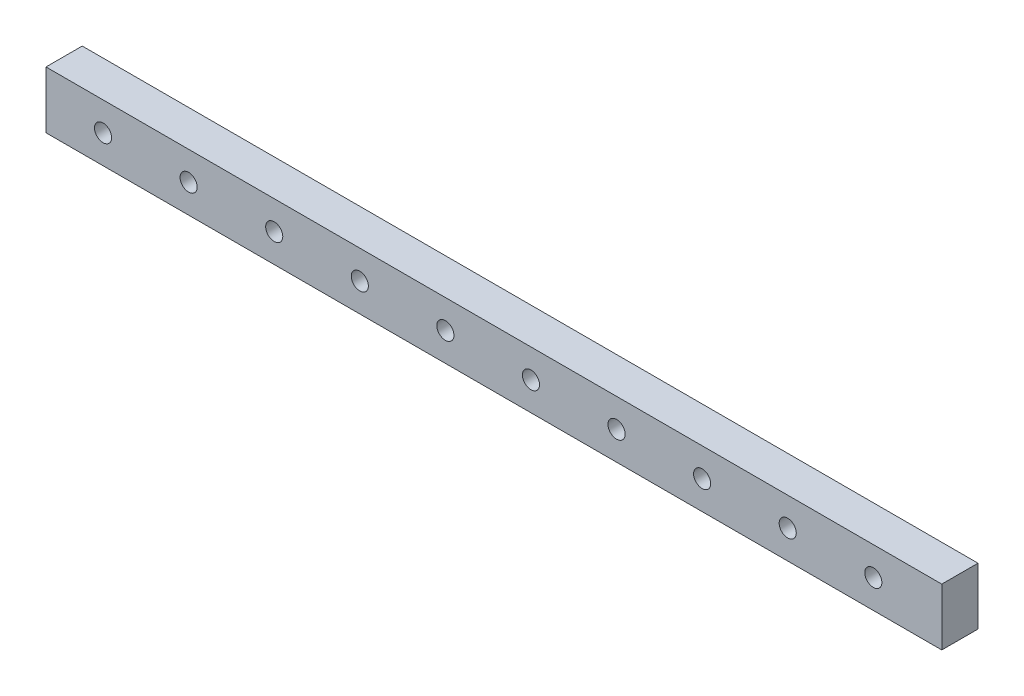
from build123d import *

# Parameters (mm, degrees)
SKETCH1_W           = 157
SKETCH1_H           = 10
BOSS_EXTRUDE1_DEPTH = 6.35
SKETCH2_R           = 1.5
CUT_EXTRUDE1_DEPTH  = 86.330289506


with BuildPart() as part:
    # Sketch1 → Boss-Extrude1 (new body)
    with BuildSketch(Plane.XY):
        with Locations((6.40612596, -0.64673194)):
            Rectangle(SKETCH1_W, SKETCH1_H)
    extrude(amount=BOSS_EXTRUDE1_DEPTH)

    # Sketch2 → Cut-Extrude1 (cut, through all)
    with BuildSketch(Plane.XY.offset(6.35)):
        with Locations((-62.09387404, -0.64673194)):
            Circle(SKETCH2_R)
        with Locations((-47.09387404, -0.64673194)):
            Circle(SKETCH2_R)
        with Locations((-32.09387404, -0.64673194)):
            Circle(SKETCH2_R)
        with Locations((-17.09387404, -0.64673194)):
            Circle(SKETCH2_R)
        with Locations((-2.09387404, -0.64673194)):
            Circle(SKETCH2_R)
        with Locations((12.90612596, -0.64673194)):
            Circle(SKETCH2_R)
        with Locations((27.90612596, -0.64673194)):
            Circle(SKETCH2_R)
        with Locations((42.90612596, -0.64673194)):
            Circle(SKETCH2_R)
        with Locations((57.90612596, -0.64673194)):
            Circle(SKETCH2_R)
        with Locations((72.90612596, -0.64673194)):
            Circle(SKETCH2_R)
    extrude(amount=-CUT_EXTRUDE1_DEPTH, mode=Mode.SUBTRACT)


solid = part.part
